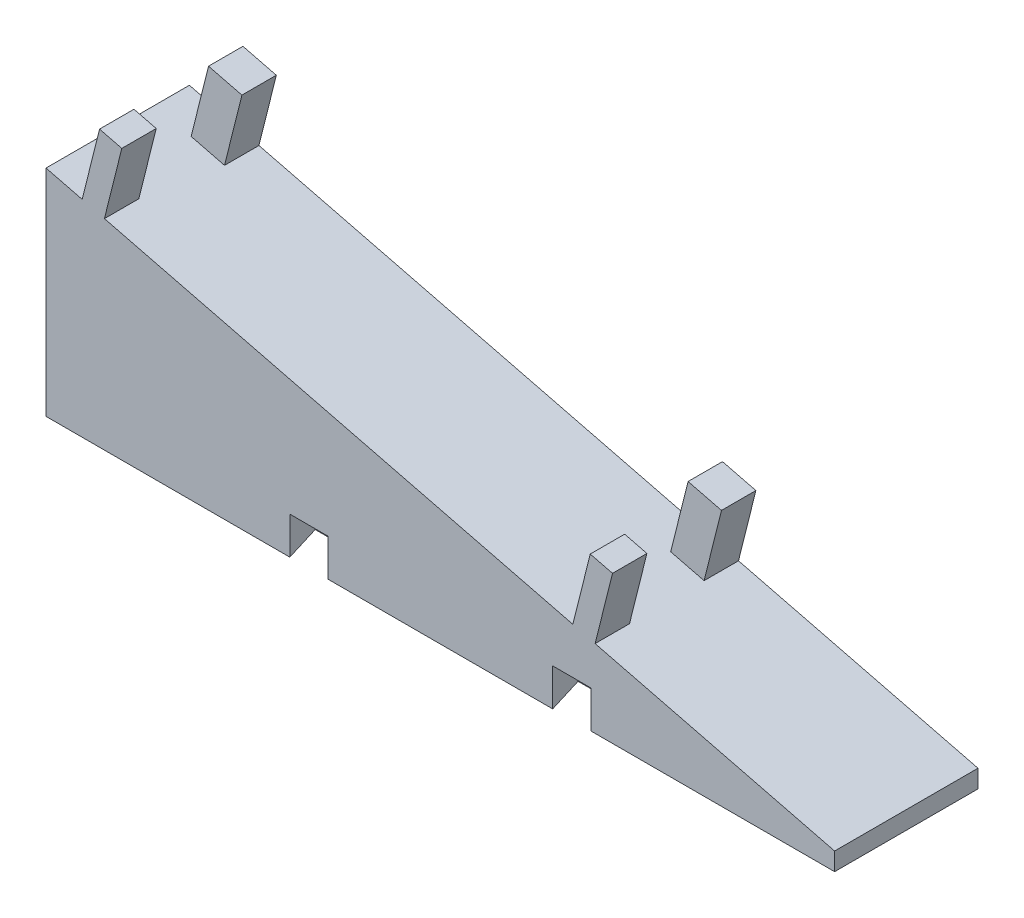
from build123d import *

# Parameters (mm, degrees)
BOSS_EXTRUDE1_DEPTH      = 10
BOSS_EXTRUDE1_DEPTH_BACK = 10
SKETCH2_W                = 4.8
SKETCH2_H                = 4.8
SKETCH2_W_2              = 3.2
BOSS_EXTRUDE2_DEPTH      = 10
CUT_EXTRUDE1_DEPTH       = 5.2


with BuildPart() as part:
    # Sketch1 → Boss-Extrude1 (new, two sides: drawn at the far end of the back side and taken through both)
    with BuildSketch(Plane.XY.offset(-BOSS_EXTRUDE1_DEPTH_BACK)):
        Polygon((-55, 21.875), (55, -5.625), (55, -8.125), (-55, -8.125), align=None)
    extrude(amount=BOSS_EXTRUDE1_DEPTH + BOSS_EXTRUDE1_DEPTH_BACK)

    # Sketch2 → Boss-Extrude2 (add)
    with BuildSketch(Plane(origin=(1.911764706, 7.647058824, 0), x_dir=(0.970142500145332, -0.24253562503633289, 0), z_dir=(0.24253562503633289, 0.970142500145332, 0))):
        with Locations((-51.063304306, 7.6)):
            Rectangle(SKETCH2_W, SKETCH2_H)
        with Locations((-51.863304306, -7.6)):
            Rectangle(SKETCH2_W_2, SKETCH2_H)
        with Locations((18.686695694, -7.6)):
            Rectangle(SKETCH2_W_2, SKETCH2_H)
        with Locations((17.886695694, 7.6)):
            Rectangle(SKETCH2_W, SKETCH2_H)
    extrude(amount=BOSS_EXTRUDE2_DEPTH)

    # Sketch3 → Cut-Extrude1 (cut)
    with BuildSketch(Plane.XZ.offset(8.125)):
        Polygon((15.692093342, -10.058542854), (14.11294757, -4.9), (22.553719096, -4.9), (20.974573324, -10.058542854), align=None)
        Polygon((-20.974573324, -10.058542854), (-22.553719096, -4.9), (-14.11294757, -4.9), (-15.692093342, -10.058542854), align=None)
        Polygon((-20.974573324, 10.058542854), (-22.553719096, 4.9), (-14.11294757, 4.9), (-15.692093342, 10.058542854), align=None)
        Polygon((15.692093342, 10.058542854), (14.11294757, 4.9), (22.553719096, 4.9), (20.974573324, 10.058542854), align=None)
    extrude(amount=-CUT_EXTRUDE1_DEPTH, mode=Mode.SUBTRACT)


solid = part.part
